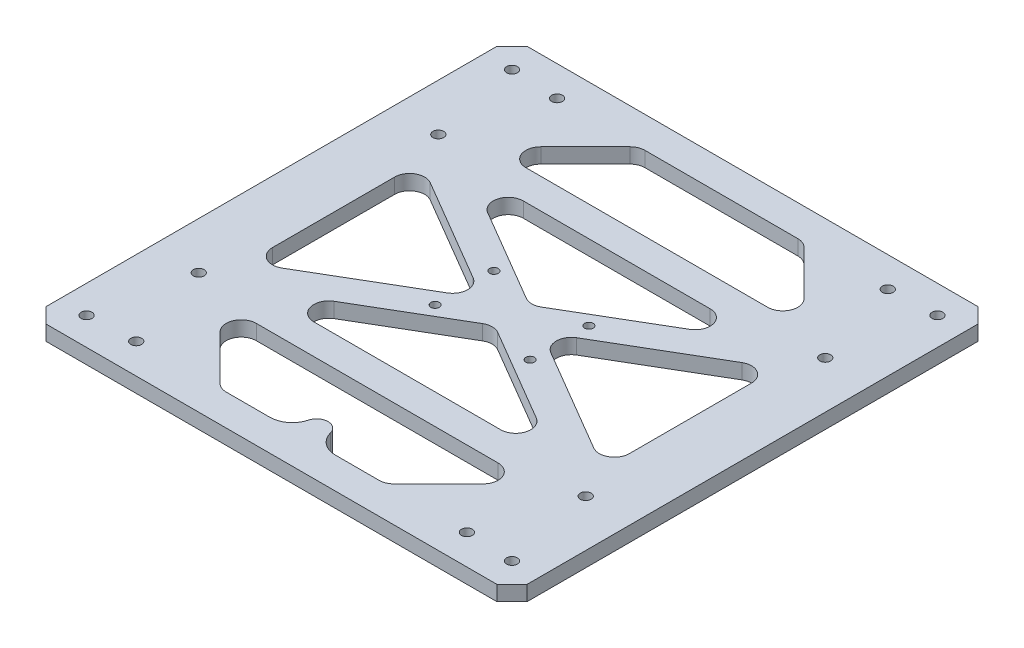
from build123d import *

# Parameters (mm, degrees)
BOSS_EXTRUDE1_DEPTH     = 6.35
SKETCH3_R               = 2.286
CUT_EXTRUDE2_DEPTH      = 288.438345563
SKETCH4_R               = 2.286
CUT_EXTRUDE3_DEPTH      = 288.438345563
SKETCH5_W               = 176.1617
SKETCH5_H               = 113.89106
SKETCH5_R               = 2.286
BOSS_EXTRUDE2_DEPTH     = 6.35
FILLET1_R               = 6.35
BOSS_EXTRUDE3_DEPTH     = 6.35
SKETCH8_R               = 4.826
SKETCH8_R_2             = 2.286
BOSS_EXTRUDE4_DEPTH     = 6.35
SKETCH9_R               = 3.8354
CUT_EXTRUDE4_DEPTH      = 3.81
SKETCH10_R              = 1.8034
CUT_EXTRUDE5_DEPTH      = 288.547744905
CUT_EXTRUDE6_DEPTH      = 288.438345563
CUT_EXTRUDE6_DEPTH_BACK = 288.438345563
SKETCH11_R              = 2.286


with BuildPart() as part:
    # Sketch1 → Boss-Extrude1 (new body)
    with BuildSketch(Plane(origin=(0, 0, 0), x_dir=(1, 0, 0), z_dir=(0, 1, 0))):
        Polygon((0, 196.85), (6.35, 203.2), (196.85, 203.2), (203.2, 196.85), (203.2, 6.35), (196.85, 0), (6.35, 0), (0, 6.35), align=None)
    extrude(amount=BOSS_EXTRUDE1_DEPTH)

    # Sketch3 → Cut-Extrude2 (cut, through all)
    with BuildSketch(Plane(origin=(0, 6.35, 0), x_dir=(1, 0, 0), z_dir=(0, 1, 0))):
        with Locations(Location((11.73734, 11.73734, 0), (0, 0, 270))):
            Circle(SKETCH3_R)
        with Locations(Location((191.46266, 11.73734, 0), (0, 0, 270))):
            Circle(SKETCH3_R)
        with Locations(Location((191.46266, 191.46266, 0), (0, 0, 270))):
            Circle(SKETCH3_R)
        with Locations(Location((11.73734, 191.46266, 0), (0, 0, 270))):
            Circle(SKETCH3_R)
    extrude(amount=-CUT_EXTRUDE2_DEPTH, mode=Mode.SUBTRACT)

    # Sketch4 → Cut-Extrude3 (cut, through all)
    with BuildSketch(Plane(origin=(0, 6.35, 0), x_dir=(1, 0, 0), z_dir=(0, 1, 0))):
        with Locations(Location((19.86915, 152.19553, 0), (0, 0, 270))):
            Circle(SKETCH4_R)
        with Locations(Location((183.33085, 152.19553, 0), (0, 0, 270))):
            Circle(SKETCH4_R)
        with Locations(Location((183.33085, 51.00447, 0), (0, 0, 270))):
            Circle(SKETCH4_R)
        with Locations(Location((19.86915, 51.00447, 0), (0, 0, 270))):
            Circle(SKETCH4_R)
        Polygon((16.69415, 140.040273879), (66.688363593, 190.034487472), (136.511636407, 190.034487472), (186.50585, 140.040273879), (186.50585, 63.159726121), (136.511636407, 13.165512528), (66.688363593, 13.165512528), (16.69415, 63.159726121), align=None)
    extrude(amount=-CUT_EXTRUDE3_DEPTH, mode=Mode.SUBTRACT)

    # Sketch5 → Boss-Extrude2 (add)
    with BuildSketch(Plane(origin=(0, 6.35, 0), x_dir=(1, 0, 0), z_dir=(0, 1, 0))):
        with Locations((101.6, 101.6)):
            Rectangle(SKETCH5_W, SKETCH5_H)
        with Locations(Location((183.33085, 51.00447, 0), (0, 0, 270))):
            Circle(SKETCH5_R, mode=Mode.SUBTRACT)
        with Locations(Location((183.33085, 152.19553, 0), (0, 0, 270))):
            Circle(SKETCH5_R, mode=Mode.SUBTRACT)
        with Locations(Location((19.86915, 152.19553, 0), (0, 0, 270))):
            Circle(SKETCH5_R, mode=Mode.SUBTRACT)
        with Locations(Location((19.86915, 51.00447, 0), (0, 0, 270))):
            Circle(SKETCH5_R, mode=Mode.SUBTRACT)
        with BuildLine():
            Line((141.073627551, 145.84553), (62.126372449, 145.84553))
            ThreePointArc((62.126372449, 145.84553), (55.998680779, 141.161031366), (58.911985411, 134.019197653))
            Line((58.911985411, 134.019197653), (98.385612962, 110.849764408))
            ThreePointArc((98.385612962, 110.849764408), (101.6, 109.976096755), (104.814387038, 110.849764408))
            Line((104.814387038, 110.849764408), (144.288014589, 134.019197653))
            ThreePointArc((144.288014589, 134.019197653), (147.201319221, 141.161031366), (141.073627551, 145.84553))
        make_face(mode=Mode.SUBTRACT)
        with BuildLine():
            Line((26.21915, 127.3922384), (26.21915, 75.8077616))
            ThreePointArc((26.21915, 75.8077616), (29.413904977, 70.297141957), (35.783537038, 70.331429253))
            Line((35.783537038, 70.331429253), (79.725622352, 96.123667653))
            ThreePointArc((79.725622352, 96.123667653), (82.861235314, 101.6), (79.725622352, 107.076332347))
            Line((79.725622352, 107.076332347), (35.783537038, 132.868570747))
            ThreePointArc((35.783537038, 132.868570747), (29.413904977, 132.902858043), (26.21915, 127.3922384))
        make_face(mode=Mode.SUBTRACT)
        with BuildLine():
            Line((62.126372449, 57.35447), (141.073627551, 57.35447))
            ThreePointArc((141.073627551, 57.35447), (147.201319221, 62.038968634), (144.288014589, 69.180802347))
            Line((144.288014589, 69.180802347), (104.814387038, 92.350235592))
            ThreePointArc((104.814387038, 92.350235592), (101.6, 93.223903245), (98.385612962, 92.350235592))
            Line((98.385612962, 92.350235592), (58.911985411, 69.180802347))
            ThreePointArc((58.911985411, 69.180802347), (55.998680779, 62.038968634), (62.126372449, 57.35447))
        make_face(mode=Mode.SUBTRACT)
        with BuildLine():
            Line((176.98085, 75.8077616), (176.98085, 127.3922384))
            ThreePointArc((176.98085, 127.3922384), (173.786095023, 132.902858043), (167.416462962, 132.868570747))
            Line((167.416462962, 132.868570747), (123.474377648, 107.076332347))
            ThreePointArc((123.474377648, 107.076332347), (120.338764686, 101.6), (123.474377648, 96.123667653))
            Line((123.474377648, 96.123667653), (167.416462962, 70.331429253))
            ThreePointArc((167.416462962, 70.331429253), (173.786095023, 70.297141957), (176.98085, 75.8077616))
        make_face(mode=Mode.SUBTRACT)
    extrude(amount=-BOSS_EXTRUDE2_DEPTH)

    # Fillet1
    fillet1_edges = [part.edges().sort_by_distance(p)[0] for p in [
        (66.688363593, 3.175, -190.034487472),
        (136.511636407, 3.175, -190.034487472),
        (136.511636407, 3.175, -13.165512528),
        (66.688363593, 3.175, -13.165512528),
        (35.199406121, 3.175, -44.65447),
        (168.000593879, 3.175, -158.54553),
        (35.199406121, 3.175, -158.54553),
        (168.000593879, 3.175, -44.65447),
    ]]
    fillet(fillet1_edges, radius=FILLET1_R)

    # Sketch6 → Boss-Extrude3 (add)
    with BuildSketch(Plane(origin=(0, 6.35, 0), x_dir=(1, 0, 0), z_dir=(0, 1, 0))):
        with BuildLine():
            Line((87.718434183, 13.165512528), (115.481565817, 13.165512528))
            ThreePointArc((115.481565817, 13.165512528), (109.663032532, 15.149272881), (106.268137177, 20.274243151))
            ThreePointArc((106.268137177, 20.274243151), (101.6, 23.876), (96.931862823, 20.274243151))
            ThreePointArc((96.931862823, 20.274243151), (93.536967468, 15.149272881), (87.718434183, 13.165512528))
        make_face()
    extrude(amount=-BOSS_EXTRUDE3_DEPTH)

    # Sketch8 → Boss-Extrude4 (add)
    with BuildSketch(Plane(origin=(0, 0, 0), x_dir=(1, 0, 0), z_dir=(0, 1, 0))):
        with Locations(Location((101.6, 19.05, 0), (0, 0, 270))):
            Circle(SKETCH8_R)
        with Locations(Location((101.6, 19.05, 0), (0, 0, 270))):
            Circle(SKETCH8_R_2, mode=Mode.SUBTRACT)
    extrude(amount=-BOSS_EXTRUDE4_DEPTH)

    # Sketch9 → Cut-Extrude4 (cut)
    with BuildSketch(Plane(origin=(0, 0, 0), x_dir=(1, 0, 0), z_dir=(0, 1, 0))):
        with Locations(Location((81.536660016, 114.02022223, 0), (0, 0, 90))):
            Circle(SKETCH9_R)
        with Locations(Location((121.663339984, 114.02022223, 0), (0, 0, 90))):
            Circle(SKETCH9_R)
        with Locations(Location((121.663339984, 89.17977777, 0), (0, 0, 90))):
            Circle(SKETCH9_R)
        with Locations(Location((81.536660016, 89.17977777, 0), (0, 0, 90))):
            Circle(SKETCH9_R)
    extrude(amount=CUT_EXTRUDE4_DEPTH, mode=Mode.SUBTRACT)

    # Sketch10 → Cut-Extrude5 (cut, through all)
    with BuildSketch(Plane(origin=(0, 3.81, 0), x_dir=(-1, 0, 0), z_dir=(0, -1, 0))):
        with Locations(Location((-81.536660016, 114.02022223, 0), (0, 0, 90))):
            Circle(SKETCH10_R)
        with Locations(Location((-121.663339984, 114.02022223, 0), (0, 0, 90))):
            Circle(SKETCH10_R)
        with Locations(Location((-121.663339984, 89.17977777, 0), (0, 0, 90))):
            Circle(SKETCH10_R)
        with Locations(Location((-81.536660016, 89.17977777, 0), (0, 0, 90))):
            Circle(SKETCH10_R)
    extrude(amount=-CUT_EXTRUDE5_DEPTH, mode=Mode.SUBTRACT)

    # Sketch11 → Cut-Extrude6 (cut, two sides: drawn at the far end of the back side and taken through both)
    with BuildSketch(Plane.XZ.offset(-CUT_EXTRUDE6_DEPTH_BACK)):
        with Locations(Location((31.75, -12.7, 0), (0, 0, 270))):
            Circle(SKETCH11_R)
        with Locations(Location((171.45, -12.7, 0), (0, 0, 270))):
            Circle(SKETCH11_R)
        with Locations(Location((171.45, -190.5, 0), (0, 0, 270))):
            Circle(SKETCH11_R)
        with Locations(Location((31.75, -190.5, 0), (0, 0, 270))):
            Circle(SKETCH11_R)
    extrude(amount=CUT_EXTRUDE6_DEPTH + CUT_EXTRUDE6_DEPTH_BACK, mode=Mode.SUBTRACT)


solid = part.part
